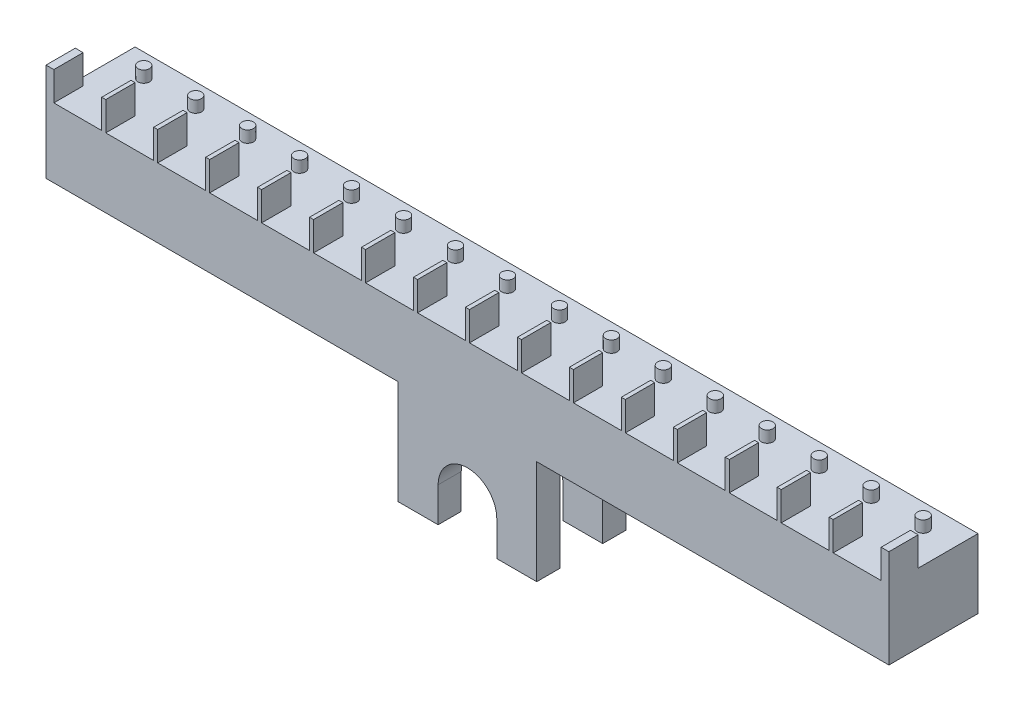
from build123d import *

# Parameters (mm, degrees)
SKETCH1_W                 = 73
SKETCH1_H                 = 7.715
BOSS_EXTRUDE1_DEPTH       = 6
SKETCH2_R                 = 0.5
BOSS_EXTRUDE2_DEPTH       = 1
SKETCH3_W                 = 0.35
SKETCH3_H                 = 2.54
BOSS_EXTRUDE3_DEPTH       = 2.5
SKETCH4_W                 = 0.325
SKETCH4_H                 = 2.5
BOSS_EXTRUDE4_DEPTH       = 2.54
BOSS_EXTRUDE12_DEPTH      = 5.715
BOSS_EXTRUDE12_DEPTH_BACK = 2
SKETCH13_W                = 12
SKETCH13_H                = 3.715
CUT_EXTRUDE1_DEPTH        = 39.025139382


with BuildPart() as part:
    # Sketch1 → Boss-Extrude1 (new body)
    with BuildSketch(Plane(origin=(0, 0, 0), x_dir=(1, 0, 0), z_dir=(0, 1, 0))):
        with Locations((0, -1.8575)):
            Rectangle(SKETCH1_W, SKETCH1_H)
    extrude(amount=BOSS_EXTRUDE1_DEPTH)

    # Sketch2 → Boss-Extrude2 (add)
    with BuildSketch(Plane(origin=(0, 6, 0), x_dir=(1, 0, 0), z_dir=(0, 1, 0))):
        with Locations(Location((2.25, 0, 0), (0, 0, 90))):
            Circle(SKETCH2_R)
        with Locations(Location((6.75, 0, 0), (0, 0, 90))):
            Circle(SKETCH2_R)
        with Locations(Location((11.25, 0, 0), (0, 0, 90))):
            Circle(SKETCH2_R)
        with Locations(Location((15.75, 0, 0), (0, 0, 90))):
            Circle(SKETCH2_R)
        with Locations(Location((20.25, 0, 0), (0, 0, 90))):
            Circle(SKETCH2_R)
        with Locations(Location((24.75, 0, 0), (0, 0, 90))):
            Circle(SKETCH2_R)
        with Locations(Location((29.25, 0, 0), (0, 0, 90))):
            Circle(SKETCH2_R)
        with Locations(Location((33.75, 0, 0), (0, 0, 90))):
            Circle(SKETCH2_R)
        with Locations(Location((-33.75, 0, 0), (0, 0, 90))):
            Circle(SKETCH2_R)
        with Locations(Location((-29.25, 0, 0), (0, 0, 90))):
            Circle(SKETCH2_R)
        with Locations(Location((-24.75, 0, 0), (0, 0, 90))):
            Circle(SKETCH2_R)
        with Locations(Location((-20.25, 0, 0), (0, 0, 90))):
            Circle(SKETCH2_R)
        with Locations(Location((-15.75, 0, 0), (0, 0, 90))):
            Circle(SKETCH2_R)
        with Locations(Location((-11.25, 0, 0), (0, 0, 90))):
            Circle(SKETCH2_R)
        with Locations(Location((-6.75, 0, 0), (0, 0, 90))):
            Circle(SKETCH2_R)
        with Locations(Location((-2.25, 0, 0), (0, 0, 90))):
            Circle(SKETCH2_R)
    extrude(amount=BOSS_EXTRUDE2_DEPTH)

    # Sketch3 → Boss-Extrude3 (add)
    with BuildSketch(Plane(origin=(0, 6, 0), x_dir=(1, 0, 0), z_dir=(0, 1, 0))):
        with Locations((4.5, -4.445)):
            Rectangle(SKETCH3_W, SKETCH3_H)
        with Locations((0, -4.445)):
            Rectangle(SKETCH3_W, SKETCH3_H)
        with Locations((9, -4.445)):
            Rectangle(SKETCH3_W, SKETCH3_H)
        with Locations((13.5, -4.445)):
            Rectangle(SKETCH3_W, SKETCH3_H)
        with Locations((18, -4.445)):
            Rectangle(SKETCH3_W, SKETCH3_H)
        with Locations((22.5, -4.445)):
            Rectangle(SKETCH3_W, SKETCH3_H)
        with Locations((27, -4.445)):
            Rectangle(SKETCH3_W, SKETCH3_H)
        with Locations((31.5, -4.445)):
            Rectangle(SKETCH3_W, SKETCH3_H)
        with Locations((36, -4.445)):
            Rectangle(SKETCH3_W, SKETCH3_H)
        with Locations((-4.5, -4.445)):
            Rectangle(SKETCH3_W, SKETCH3_H)
        with Locations((-9, -4.445)):
            Rectangle(SKETCH3_W, SKETCH3_H)
        with Locations((-13.5, -4.445)):
            Rectangle(SKETCH3_W, SKETCH3_H)
        with Locations((-18, -4.445)):
            Rectangle(SKETCH3_W, SKETCH3_H)
        with Locations((-22.5, -4.445)):
            Rectangle(SKETCH3_W, SKETCH3_H)
        with Locations((-27, -4.445)):
            Rectangle(SKETCH3_W, SKETCH3_H)
        with Locations((-31.5, -4.445)):
            Rectangle(SKETCH3_W, SKETCH3_H)
        with Locations((-36, -4.445)):
            Rectangle(SKETCH3_W, SKETCH3_H)
    extrude(amount=BOSS_EXTRUDE3_DEPTH)

    # Sketch4 → Boss-Extrude4 (add)
    with BuildSketch(Plane.XY.offset(3.175)):
        with Locations((-36.3375, 7.25)):
            Rectangle(SKETCH4_W, SKETCH4_H)
        with Locations((36.3375, 7.25)):
            Rectangle(SKETCH4_W, SKETCH4_H)
    extrude(amount=BOSS_EXTRUDE4_DEPTH)

    # Sketch12 → Boss-Extrude12 (add, two sides: drawn at the far end of the back side and taken through both)
    with BuildSketch(Plane.XY.offset(-BOSS_EXTRUDE12_DEPTH_BACK)):
        with BuildLine():
            Line((-2.54, -6), (-2.54, -9))
            Line((-2.54, -9), (-6, -9))
            Line((-6, -9), (-6, 0))
            Line((-6, 0), (6, 0))
            Line((6, 0), (6, -9))
            Line((6, -9), (2.54, -9))
            Line((2.54, -9), (2.54, -6))
            ThreePointArc((2.54, -6), (0, -3.46), (-2.54, -6))
        make_face()
    extrude(amount=BOSS_EXTRUDE12_DEPTH + BOSS_EXTRUDE12_DEPTH_BACK)

    # Sketch13 → Cut-Extrude1 (cut, through all)
    with BuildSketch(Plane.XZ):
        with Locations((0, 1.8575)):
            Rectangle(SKETCH13_W, SKETCH13_H)
    extrude(amount=CUT_EXTRUDE1_DEPTH, mode=Mode.SUBTRACT)


solid = part.part
